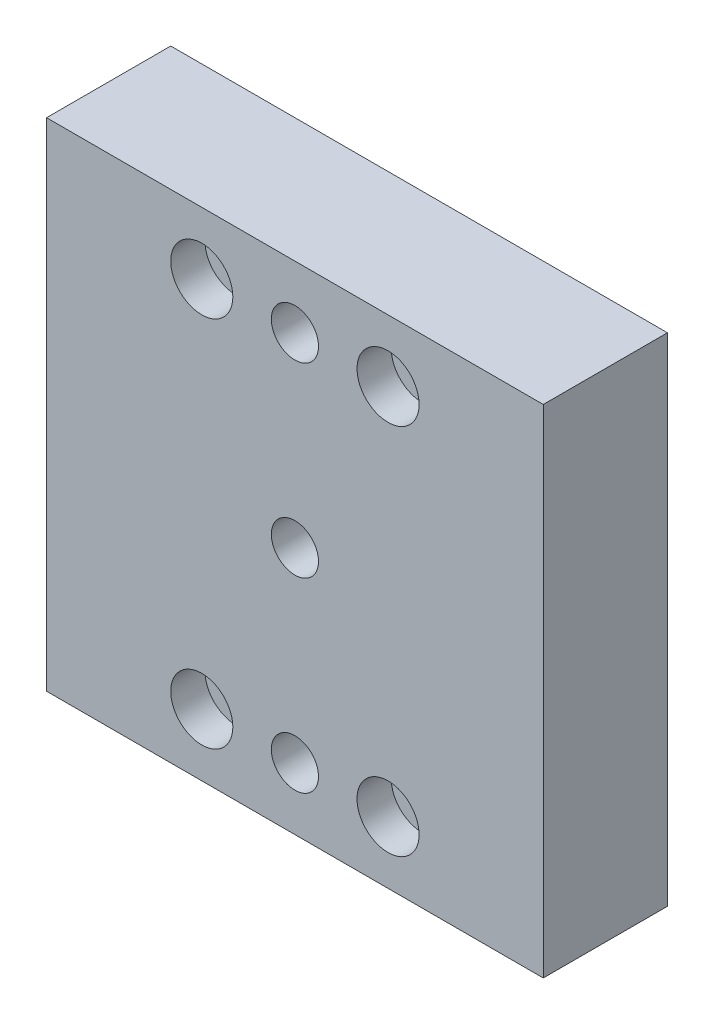
from build123d import *

# Parameters (mm, degrees)
SKETCH1_W           = 50.8
SKETCH1_H           = 50.8
BOSS_EXTRUDE1_DEPTH = 12.7
F_10_CB_D           = 4.826
F_10_CB_CBORE_D     = 6.35
F_10_CB_CBORE_DEPTH = 4.826
F_6_CB_D            = 3.5052
F_6_CB_DEPTH        = 50.8
F_6_CB_CBORE_D      = 6.35
F_6_CB_CBORE_DEPTH  = 3.5052


with BuildPart() as part:
    # Sketch1 → Boss-Extrude1 (new body)
    with BuildSketch(Plane.XY):
        Rectangle(SKETCH1_W, SKETCH1_H)
    extrude(amount=BOSS_EXTRUDE1_DEPTH)

    # #10 CB (through all)
    with Locations(Plane(origin=(0, 0, 0), x_dir=(1, 0, 0), z_dir=(0, 0, -1))):
        with Locations((0, -19.05), (0, 0), (0, 19.05)):
            CounterBoreHole(F_10_CB_D / 2, F_10_CB_CBORE_D / 2, F_10_CB_CBORE_DEPTH)

    # #6 CB
    with Locations(Plane.XY.offset(12.7)):
        with Locations((-9.525, 19.05), (-9.525, -19.05), (9.525, -19.05), (9.525, 19.05)):
            CounterBoreHole(F_6_CB_D / 2, F_6_CB_CBORE_D / 2, F_6_CB_CBORE_DEPTH, depth=F_6_CB_DEPTH)


solid = part.part
